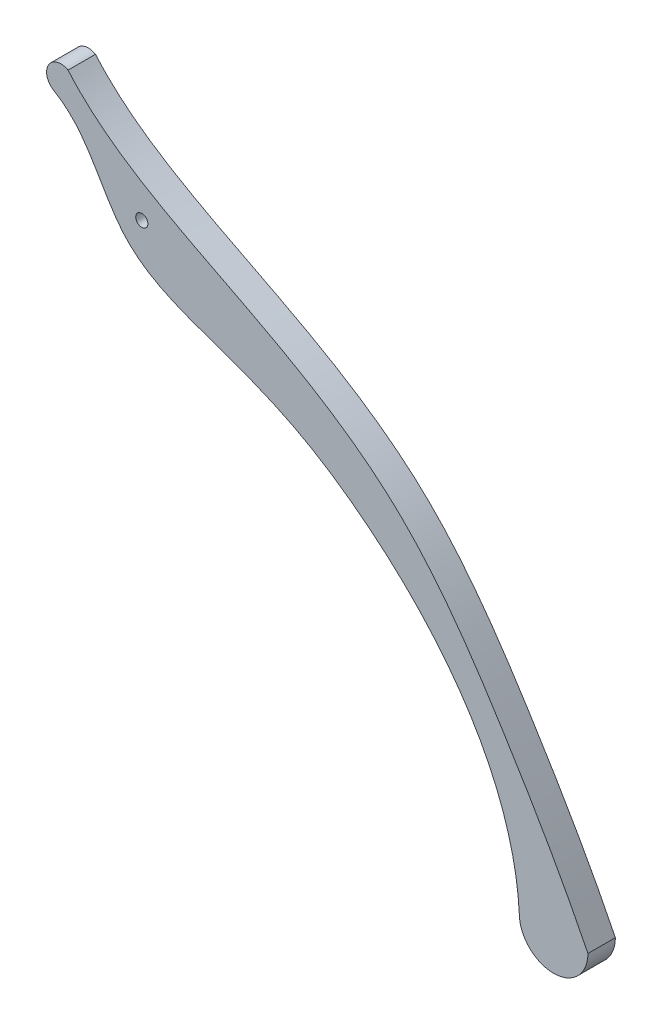
from build123d import *

# Parameters (mm, degrees)
ESQUISSE1_R        = 2.65
BOSS_EXTRU_1_DEPTH = 12


with BuildPart() as part:
    # Esquisse1 → Boss.-Extru.1 (new body)
    with BuildSketch(Plane.XY):
        with BuildLine():
            ThreePointArc((165, -180), (180, -195), (195, -180))
            add(Edge.make_bspline(
                [(-32.230339059, 40.767997833), (-21.487067244, 28.285755558), (6.817422192, 8.985627157), (57.907646488, -15.335442256), (116.000678334, -50.549955104), (158.250235065, -113.410127761), (183.811606987, -157.342321495), (195, -180)],
                knots=[0, 0, 0, 0, 0.150864181, 0.31367633, 0.525224537, 0.76791969, 1, 1, 1, 1], degree=3))
            ThreePointArc((-32.230339059, 40.767997833), (-40.767997833, 38.480339059), (-38.480339059, 29.942680286))
            add(Edge.make_bspline(
                [(-38.480339059, 29.942680286), (-22.680791601, 20.937098179), (-13.788414104, -16.124755263), (31.914743736, -30.151499795), (67.253398056, -43.969392634), (125.061638872, -82.215687059), (162.607495356, -132.950915283), (165, -180)],
                knots=[0, 0, 0, 0, 0.170787223, 0.322785998, 0.434260945, 0.547848928, 1, 1, 1, 1], degree=3))
        make_face()
        Circle(ESQUISSE1_R, mode=Mode.SUBTRACT)
    extrude(amount=BOSS_EXTRU_1_DEPTH)


solid = part.part
